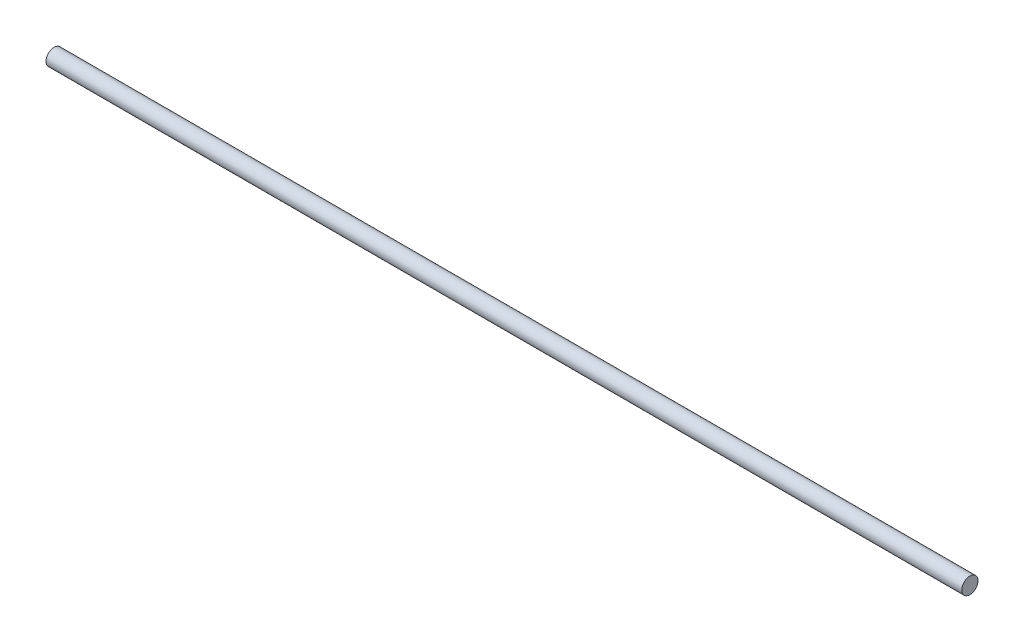
from build123d import *

# Parameters (mm, degrees)
SKETCH1_R           = 2.5
BOSS_EXTRUDE1_DEPTH = 282


with BuildPart() as part:
    # Sketch1 → Boss-Extrude1 (new body)
    with BuildSketch(Plane(origin=(0, 0, 0), x_dir=(0, 0, -1), z_dir=(1, 0, 0))):
        Circle(SKETCH1_R)
    extrude(amount=BOSS_EXTRUDE1_DEPTH)


solid = part.part
